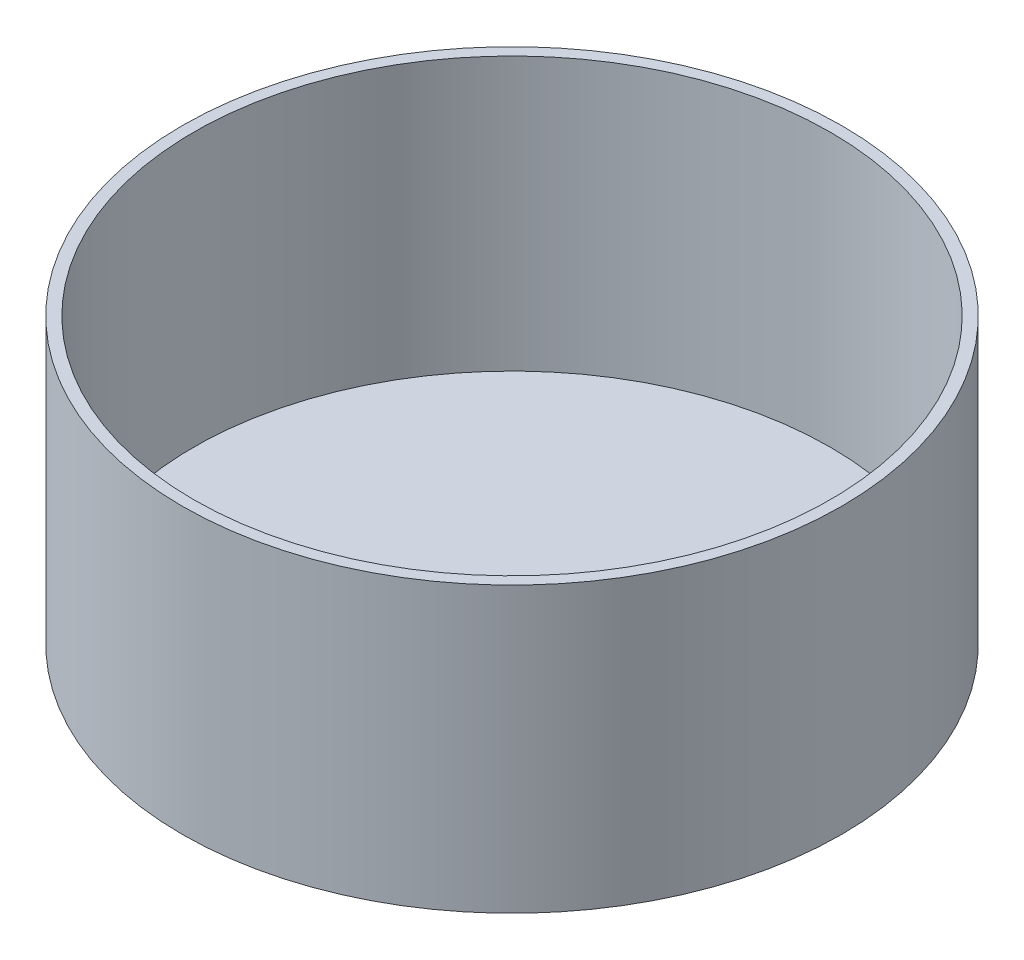
from build123d import *

# Parameters (mm, degrees)
ESQUISSE2_R             = 58
BOSS_EXTRU_1_DEPTH      = 50
ESQUISSE3_R             = 56
ENL_V_MAT_EXTRU_1_DEPTH = 48


with BuildPart() as part:
    # Esquisse2 → Boss.-Extru.1 (new body)
    with BuildSketch(Plane(origin=(0, 0, 0), x_dir=(1, 0, 0), z_dir=(0, 1, 0))):
        with Locations(Location((0, 0, 0), (0, 0, 270))):
            Circle(ESQUISSE2_R)
    extrude(amount=BOSS_EXTRU_1_DEPTH)

    # Esquisse3 → Enlèv. mat.-Extru.1 (cut)
    with BuildSketch(Plane(origin=(0, 50, 0), x_dir=(1, 0, 0), z_dir=(0, 1, 0))):
        with Locations(Location((0, 0, 0), (0, 0, 270))):
            Circle(ESQUISSE3_R)
    extrude(amount=-ENL_V_MAT_EXTRU_1_DEPTH, mode=Mode.SUBTRACT)


solid = part.part
